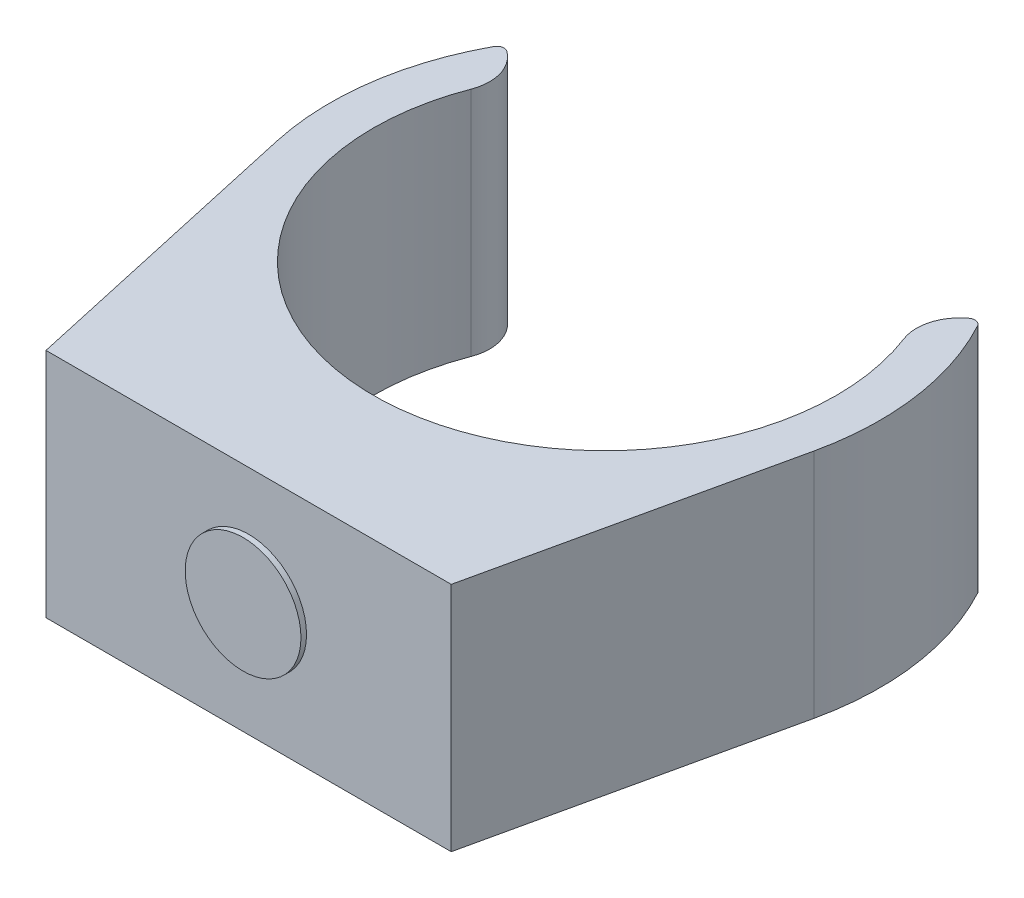
from build123d import *

# Parameters (mm, degrees)
EXTRUIR1_DEPTH      = 16
EXTRUIR2_REACH      = 58.273
EXTRUIR2_END_RADIUS = 19
EXTRUIR2_START      = 25
CROQUIS2_R          = 4
REDONDEO1_R         = 3
REDONDEO2_R         = 0.5
EXTRUIR3_START      = -16
EXTRUIR3_DEPTH      = 16


with BuildPart() as part:
    # Croquis1 → Extruir1 (new body)
    with BuildSketch(Plane(origin=(0, 0, 0), x_dir=(1, 0, 0), z_dir=(0, 1, 0))):
        with BuildLine():
            Line((16.454482672, 9.5), (13.856406461, 8))
            ThreePointArc((13.856406461, 8), (0, -16), (-13.856406461, 8))
            Line((-13.856406461, 8), (-16.454482672, 9.5))
            ThreePointArc((-16.454482672, 9.5), (0, -19), (16.454482672, 9.5))
        make_face()
    extrude(amount=EXTRUIR1_DEPTH)

    # Extruir2: up to this cylinder (the profile starts outside it)
    extruir2_end = Plane(origin=(0, 8, 0), z_dir=(0, -1, 0)) * Cylinder(EXTRUIR2_END_RADIUS, 155.546, mode=Mode.PRIVATE)
    # Croquis2 → Extruir2 (add, up to the surface)
    with BuildSketch(Plane.XY.offset(EXTRUIR2_START), mode=Mode.PRIVATE) as extruir2_sk1:
        with Locations((0, 8)):
            Circle(CROQUIS2_R)
    extruir2_tool1 = extrude(extruir2_sk1.sketch, amount=-EXTRUIR2_REACH, mode=Mode.PRIVATE) - extruir2_end
    add(extruir2_tool1.solids().sort_by_distance((0, 8, 25))[0])

    # Redondeo1
    redondeo1_edges = [part.edges().sort_by_distance(p)[0] for p in [
        (13.856406461, 8, -8),
        (-13.856406461, 8, -8),
    ]]
    fillet(redondeo1_edges, radius=REDONDEO1_R)

    # Redondeo2
    redondeo2_edges = [part.edges().sort_by_distance(p)[0] for p in [
        (16.454482672, 8, -9.5),
        (-16.454482672, 8, -9.5),
    ]]
    fillet(redondeo2_edges, radius=REDONDEO2_R)

    # Croquis3 → Extruir3 (add)
    with BuildSketch(Plane(origin=(0, 16, 0), x_dir=(1, 0, 0), z_dir=(0, 1, 0)).offset(EXTRUIR3_START)):
        with BuildLine():
            Line((-18.548840002, -4.115888068), (-14, -24.615888068))
            Line((-14, -24.615888068), (14, -24.615888068))
            Line((14, -24.615888068), (18.548840002, -4.115888068))
            Line((18.548840002, -4.115888068), (15.461547963, -4.115888068))
            ThreePointArc((15.461547963, -4.115888068), (0, -16), (-15.461547963, -4.115888068))
            Line((-15.461547963, -4.115888068), (-18.548840002, -4.115888068))
        make_face()
    extrude(amount=EXTRUIR3_DEPTH)


solid = part.part
